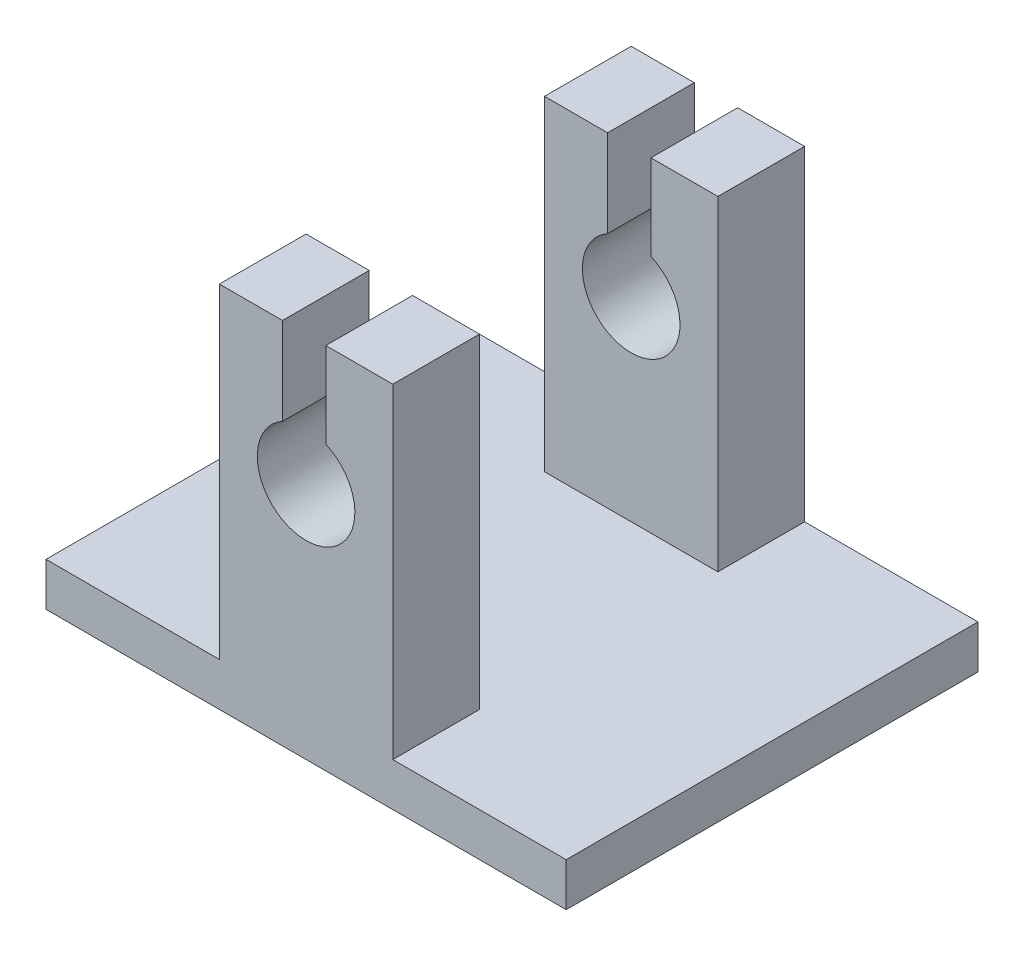
from build123d import *

# Parameters (mm, degrees)
SKETCH2_W           = 152.4
SKETCH2_H           = 120.65
BOSS_EXTRUDE2_DEPTH = 12.7
SKETCH4_W           = 50.8
SKETCH4_H           = 25.4
BOSS_EXTRUDE3_DEPTH = 95.25
CUT_EXTRUDE1_DEPTH  = 179.930335606


with BuildPart() as part:
    # Sketch2 → Boss-Extrude2 (new body)
    with BuildSketch(Plane(origin=(0, 0, 0), x_dir=(1, 0, 0), z_dir=(0, 1, 0))):
        Rectangle(SKETCH2_W, SKETCH2_H)
    extrude(amount=BOSS_EXTRUDE2_DEPTH)

    # Sketch4 → Boss-Extrude3 (add)
    with BuildSketch(Plane(origin=(0, 12.7, 0), x_dir=(1, 0, 0), z_dir=(0, 1, 0))):
        with Locations((0, -47.625)):
            Rectangle(SKETCH4_W, SKETCH4_H)
    boss_extrude3 = extrude(amount=BOSS_EXTRUDE3_DEPTH)

    # Mirror1: Boss-Extrude3 across plane
    add(boss_extrude3.mirror(Plane.XY))

    # Sketch6 → Cut-Extrude1 (cut, through all)
    with BuildSketch(Plane.XY.offset(60.325)):
        with BuildLine():
            Line((-6.911847883, 107.95), (5.788152117, 107.95))
            Line((5.788152117, 107.95), (5.788152117, 82.912540003))
            ThreePointArc((5.788152117, 82.912540003), (0.627347046, 55.576279674), (-6.911847883, 82.354359843))
            Line((-6.911847883, 82.354359843), (-6.911847883, 107.95))
        make_face()
    extrude(amount=-CUT_EXTRUDE1_DEPTH, mode=Mode.SUBTRACT)


solid = part.part
